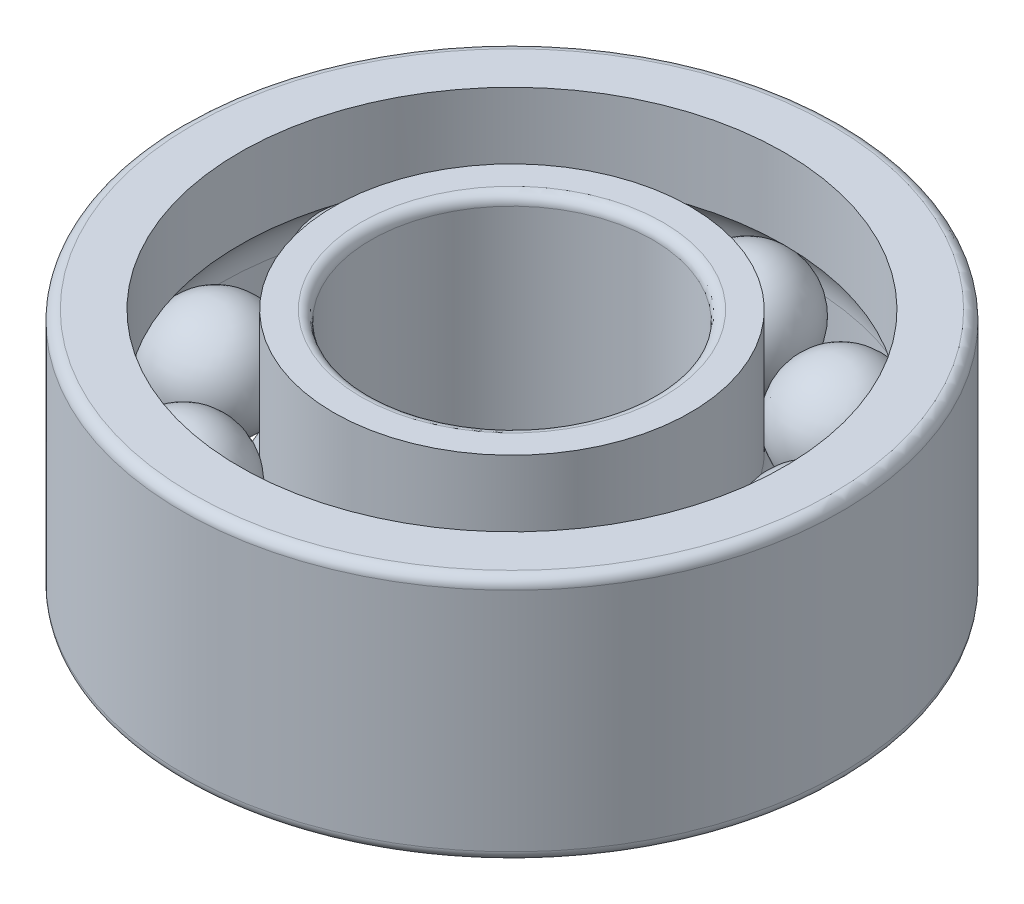
from build123d import *

# Parameters (mm, degrees)
CIRPATTERN1_COUNT = 10


with BuildPart() as part:
    # Sketch1 → Revolve1 (revolve)
    with BuildSketch(Plane(origin=(0, 0, 0), x_dir=(0, 0, -1), z_dir=(1, 0, 0)), mode=Mode.PRIVATE) as revolve1_sk:
        with BuildLine():
            Line((-16, 12.85), (-16, -12.85))
            ThreePointArc((-16, -12.85), (-16.336827202, -13.663172798), (-17.15, -14))
            Line((-17.15, -14), (-22.5, -14))
            Line((-22.5, -14), (-22.5, -4.918078893))
            ThreePointArc((-22.5, -4.918078893), (-20.839204791, -2.704163457), (-20.25, 0))
            Line((-20.25, 0), (-20.25, 14))
            Line((-20.25, 14), (-17.15, 14))
            ThreePointArc((-17.15, 14), (-16.336827202, 13.663172798), (-16, 12.85))
        make_face()
    revolve(revolve1_sk.sketch.rotate(Axis((0, 0, 0), (0, 1, 0)), 180), axis=Axis((0, 0, 0), (0, 1, 0)))


with BuildPart() as body_2:
    # Sketch2 → Revolve4 (revolve)
    with BuildSketch(Plane(origin=(0, 0, 0), x_dir=(0, 0, -1), z_dir=(1, 0, 0))):
        with BuildLine():
            Line((-26.7, 6.45), (-26.7, -6.45))
            ThreePointArc((-26.7, -6.45), (-33.15, 0), (-26.7, 6.45))
        make_face()
    revolve(axis=Axis((0, 6.45, 26.7), (0, -1, 0)))


with BuildPart() as cirpattern1_1:
    # CirPattern1: pattern copy
    add(body_2.part.rotate(Axis((0, 0, 0), (0, 1, 0)), 1 * 360 / CIRPATTERN1_COUNT))


with BuildPart() as cirpattern1_2:
    # CirPattern1: pattern copy
    add(body_2.part.rotate(Axis((0, 0, 0), (0, 1, 0)), 2 * 360 / CIRPATTERN1_COUNT))


with BuildPart() as cirpattern1_3:
    # CirPattern1: pattern copy
    add(body_2.part.rotate(Axis((0, 0, 0), (0, 1, 0)), 3 * 360 / CIRPATTERN1_COUNT))


with BuildPart() as cirpattern1_4:
    # CirPattern1: pattern copy
    add(body_2.part.rotate(Axis((0, 0, 0), (0, 1, 0)), 4 * 360 / CIRPATTERN1_COUNT))


with BuildPart() as cirpattern1_5:
    # CirPattern1: pattern copy
    add(body_2.part.rotate(Axis((0, 0, 0), (0, 1, 0)), 5 * 360 / CIRPATTERN1_COUNT))


with BuildPart() as cirpattern1_6:
    # CirPattern1: pattern copy
    add(body_2.part.rotate(Axis((0, 0, 0), (0, 1, 0)), 6 * 360 / CIRPATTERN1_COUNT))


with BuildPart() as cirpattern1_7:
    # CirPattern1: pattern copy
    add(body_2.part.rotate(Axis((0, 0, 0), (0, 1, 0)), 7 * 360 / CIRPATTERN1_COUNT))


with BuildPart() as cirpattern1_8:
    # CirPattern1: pattern copy
    add(body_2.part.rotate(Axis((0, 0, 0), (0, 1, 0)), 8 * 360 / CIRPATTERN1_COUNT))


with BuildPart() as cirpattern1_9:
    # CirPattern1: pattern copy
    add(body_2.part.rotate(Axis((0, 0, 0), (0, 1, 0)), 9 * 360 / CIRPATTERN1_COUNT))


with BuildPart() as body_2_1:
    add(body_2.part)

    # Sketch3 → Revolve5 (revolve)
    with BuildSketch(Plane(origin=(0, 0, 0), x_dir=(0, 0, -1), z_dir=(1, 0, 0)), mode=Mode.PRIVATE) as revolve5_sk:
        with BuildLine():
            Line((-33.15, -14), (-36.25, -14))
            ThreePointArc((-36.25, -14), (-37.063172798, -13.663172798), (-37.4, -12.85))
            Line((-37.4, -12.85), (-37.4, 12.85))
            ThreePointArc((-37.4, 12.85), (-37.063172798, 13.663172798), (-36.25, 14))
            Line((-36.25, 14), (-30.9, 14))
            Line((-30.9, 14), (-30.9, 4.895150662))
            ThreePointArc((-30.9, 4.895150662), (-32.556038696, 2.691661192), (-33.15, 0))
            Line((-33.15, 0), (-33.15, -14))
        make_face()
    revolve(revolve5_sk.sketch.rotate(Axis((0, 0, 0), (0, 1, 0)), 180), axis=Axis((0, 0, 0), (0, 1, 0)))


solid = Compound([part.part, cirpattern1_1.part, cirpattern1_2.part, cirpattern1_3.part, cirpattern1_4.part, cirpattern1_5.part, cirpattern1_6.part, cirpattern1_7.part, cirpattern1_8.part, cirpattern1_9.part, body_2_1.part])
